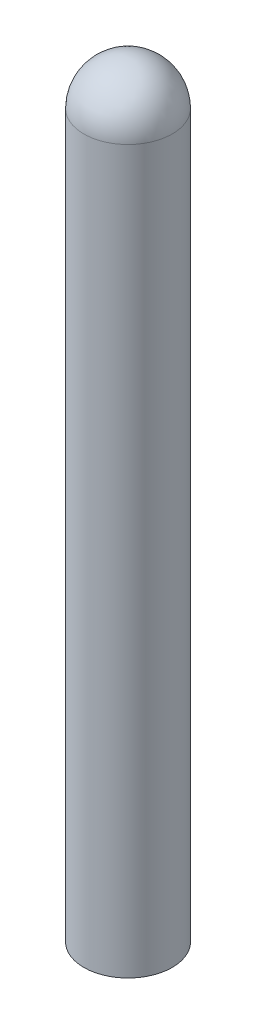
from build123d import *

# Parameters (mm, degrees)
SKETCH1_R      = 2.38125
EXTRUDE1_DEPTH = 41.275
FILLET1_R      = 2.38125


with BuildPart() as part:
    # Sketch1 → Extrude1 (new body)
    with BuildSketch(Plane(origin=(0, 0, 0), x_dir=(1, 0, 0), z_dir=(0, 1, 0))):
        with Locations(Location((0, 0, 0), (0, 0, 270))):
            Circle(SKETCH1_R)
    extrude(amount=EXTRUDE1_DEPTH)

    # Fillet1
    fillet1_edges = [part.edges().sort_by_distance(p)[0] for p in [
        (0, 41.275, -2.38125),
    ]]
    fillet(fillet1_edges, radius=FILLET1_R)


solid = part.part
